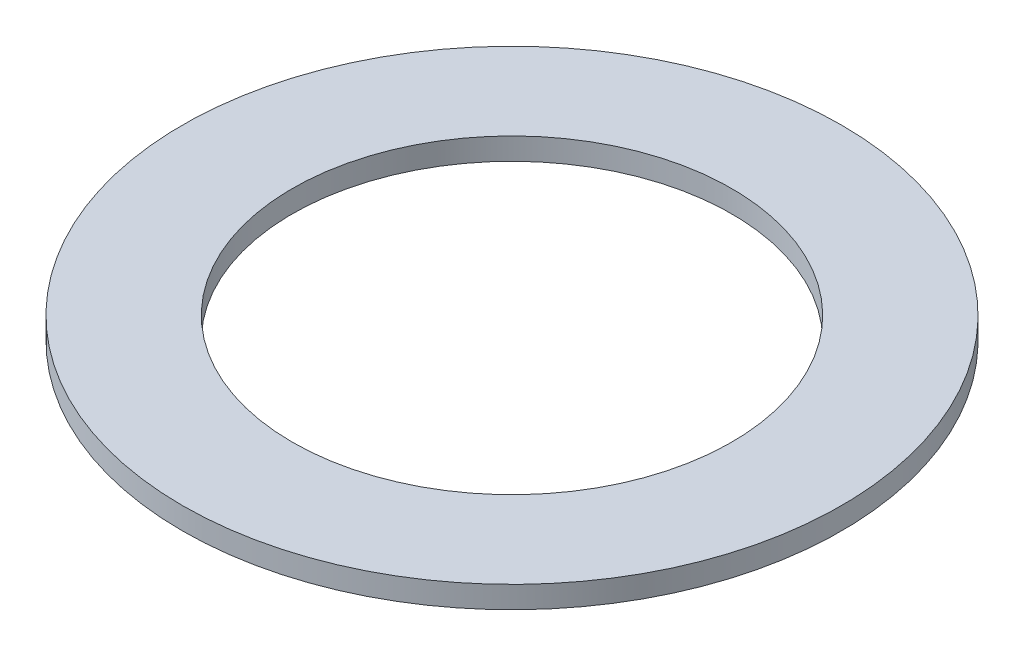
from build123d import *

# Parameters (mm, degrees)
SKETCH1_R           = 75
SKETCH1_R_2         = 50
BOSS_EXTRUDE1_DEPTH = 5


with BuildPart() as part:
    # Sketch1 → Boss-Extrude1 (new body)
    with BuildSketch(Plane(origin=(0, 0, 0), x_dir=(1, 0, 0), z_dir=(0, 1, 0))):
        with Locations(Location((0, 0, 0), (0, 0, 270))):
            Circle(SKETCH1_R)
        with Locations(Location((0, 0, 0), (0, 0, 270))):
            Circle(SKETCH1_R_2, mode=Mode.SUBTRACT)
    extrude(amount=BOSS_EXTRUDE1_DEPTH)


solid = part.part
